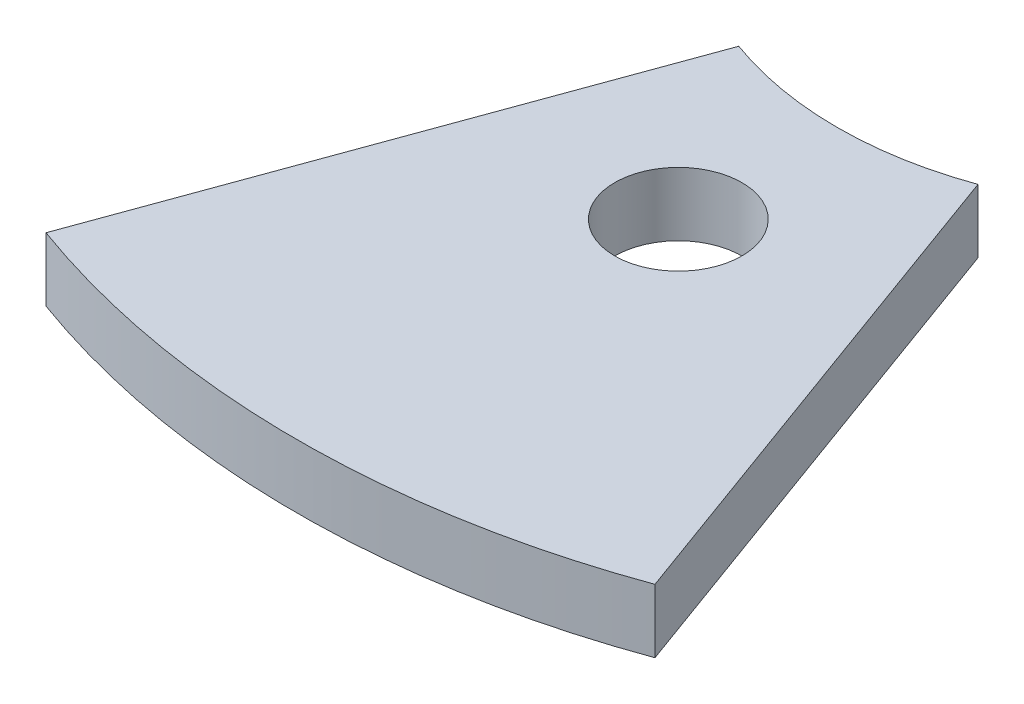
from build123d import *

# Parameters (mm, degrees)
SKETCH1_R           = 6.35
BOSS_EXTRUDE1_DEPTH = 6.35


with BuildPart() as part:
    # Sketch1 → Boss-Extrude1 (new body)
    with BuildSketch(Plane(origin=(0, 0, 0), x_dir=(1, 0, 0), z_dir=(0, 1, 0))):
        with BuildLine():
            ThreePointArc((11.945053506, 17.981235219), (0, 15.875), (-11.945053506, 17.981235219))
            Line((-11.945053506, 17.981235219), (-30.405590742, -32.738673988))
            ThreePointArc((-30.405590742, -32.738673988), (0, -38.1), (30.405590742, -32.738673988))
            Line((30.405590742, -32.738673988), (11.945053506, 17.981235219))
        make_face()
        with Locations(Location((0, 0, 0), (0, 0, 270))):
            Circle(SKETCH1_R, mode=Mode.SUBTRACT)
    extrude(amount=BOSS_EXTRUDE1_DEPTH)


solid = part.part
